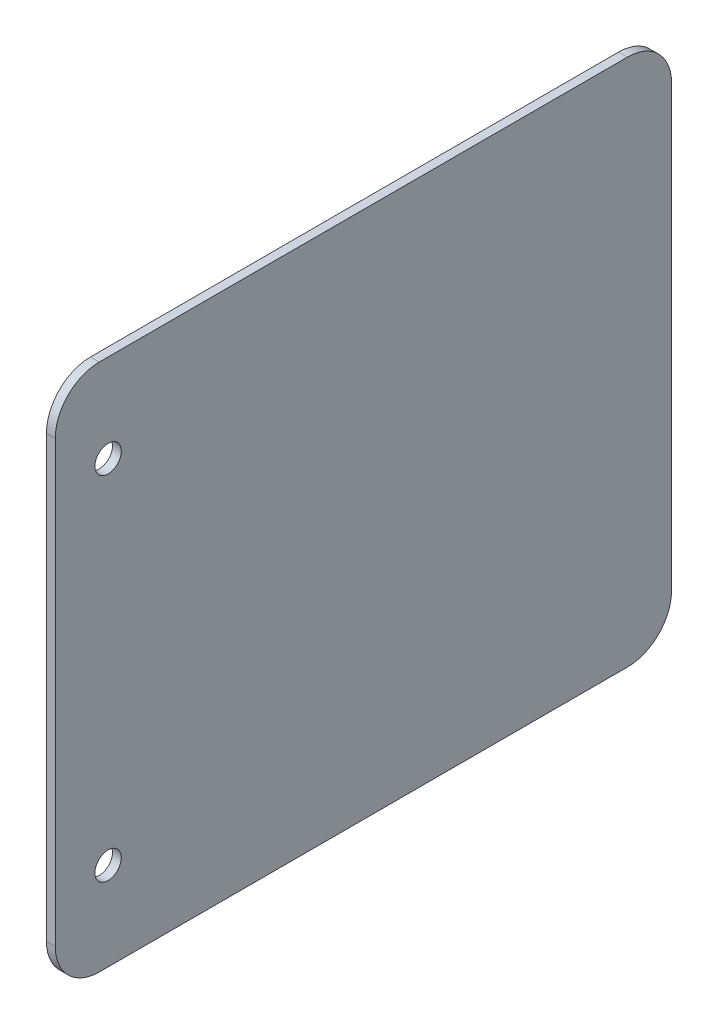
from build123d import *

# Parameters (mm, degrees)
BOSS_EXTRUDE1_DEPTH = 1
SKETCH2_R           = 1.5
CUT_EXTRUDE1_DEPTH  = 10


with BuildPart() as part:
    # Sketch1 → Boss-Extrude1 (new body)
    with BuildSketch(Plane(origin=(0, 0, 0), x_dir=(0, 0, -1), z_dir=(1, 0, 0))):
        with BuildLine():
            Line((-30, 30), (30, 30))
            ThreePointArc((30, 30), (33.535533906, 28.535533906), (35, 25))
            Line((35, 25), (35, -25))
            ThreePointArc((35, -25), (33.535533906, -28.535533906), (30, -30))
            Line((30, -30), (-30, -30))
            ThreePointArc((-30, -30), (-33.535533906, -28.535533906), (-35, -25))
            Line((-35, -25), (-35, 25))
            ThreePointArc((-35, 25), (-33.535533906, 28.535533906), (-30, 30))
        make_face()
    extrude(amount=-BOSS_EXTRUDE1_DEPTH)

    # Sketch2 → Cut-Extrude1 (cut)
    with BuildSketch(Plane(origin=(0, 0, 0), x_dir=(0, 0, -1), z_dir=(1, 0, 0))):
        with Locations((-29, 20)):
            Circle(SKETCH2_R)
        with Locations((-29, -20)):
            Circle(SKETCH2_R)
    extrude(amount=-CUT_EXTRUDE1_DEPTH, mode=Mode.SUBTRACT)


solid = part.part
